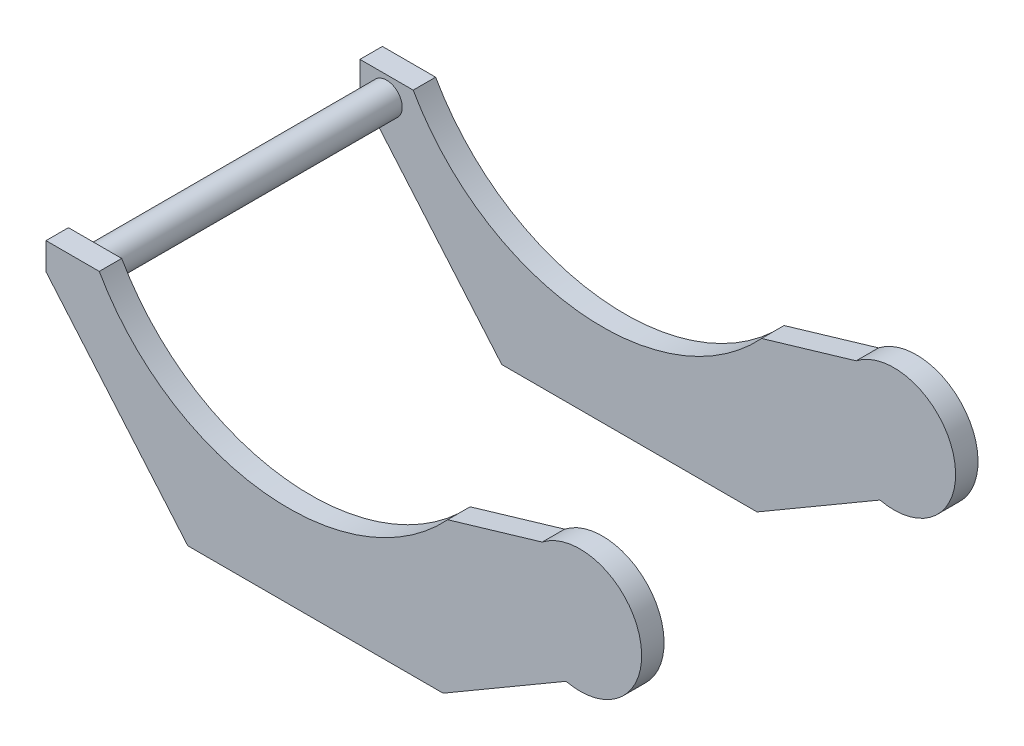
from build123d import *

# Parameters (mm, degrees)
BOSS_EXTRUDE1_DEPTH = 4
LPATTERN1_COUNT     = 2
LPATTERN1_PITCH     = 56
SKETCH2_R           = 2.789357995
BOSS_EXTRUDE2_DEPTH = 56


with BuildPart() as part:
    # Sketch1 → Boss-Extrude1 (new body)
    with BuildSketch(Plane.XY):
        with BuildLine():
            Line((-106.25, 0), (-96.75, 0))
            ThreePointArc((-96.75, 0), (-67.531499401, -19.450486235), (-34.603968254, -7.292366126))
            Line((-34.603968254, -7.292366126), (-17.738888889, -2.31334311))
            ThreePointArc((-17.738888889, -2.31334311), (-0.254682932, -8.640300495), (-13.492063492, -21.697850174))
            Line((-13.492063492, -21.697850174), (-35.416666667, -34.5))
            Line((-35.416666667, -34.5), (-80.952380952, -34.5))
            Line((-80.952380952, -34.5), (-106.25, -4.813953488))
            Line((-106.25, -4.813953488), (-106.25, 0))
        make_face()
    extrude(amount=BOSS_EXTRUDE1_DEPTH)


with BuildPart() as lpattern1_1:
    # LPattern1: pattern copy
    add(part.part.moved(Location(Vector(0, 0, 1) * (1 * LPATTERN1_PITCH))))


with BuildPart() as part_1:
    add(part.part)

    add(lpattern1_1.part)  # Boss-Extrude2 merges LPattern1_1
    # Sketch2 → Boss-Extrude2 (add)
    with BuildSketch(Plane.XY.offset(60)):
        with Locations((-101.5, -3.626457861)):
            Circle(SKETCH2_R)
    extrude(amount=-BOSS_EXTRUDE2_DEPTH)


solid = part_1.part
